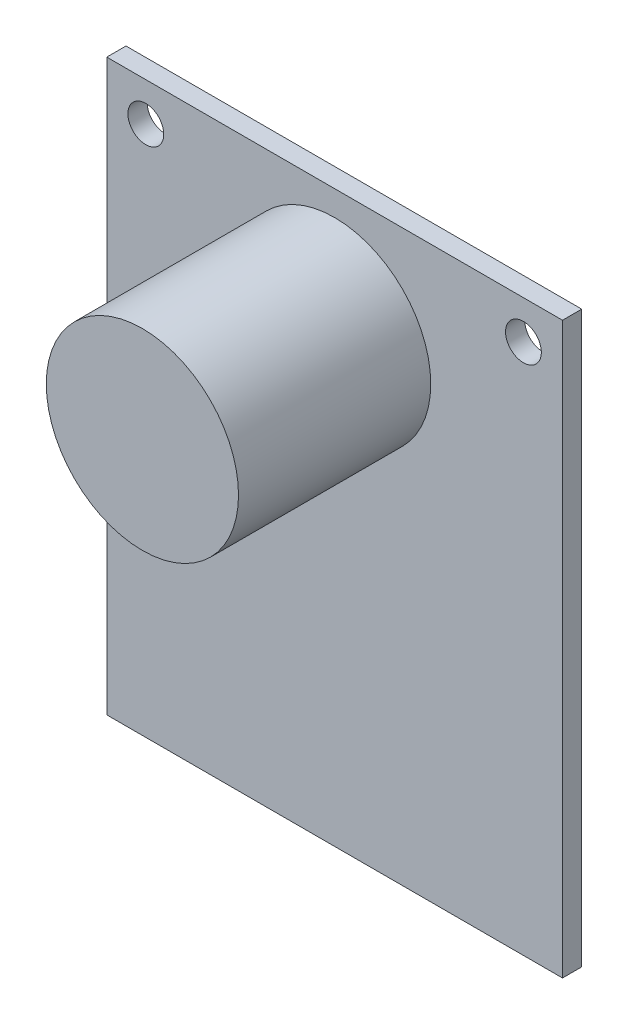
from build123d import *

# Parameters (mm, degrees)
SKETCH_1_W      = 35.56
SKETCH_1_H      = 44.45
SKETCH_1_R      = 1.397
EXTRUDE_1_DEPTH = 1.5
SKETCH_2_R      = 7.5
EXTRUDE_2_DEPTH = 15


with BuildPart() as part:
    # 草图1 → 凸台-拉伸1 (new body)
    with BuildSketch(Plane.XY):
        with Locations((0, 22.225)):
            Rectangle(SKETCH_1_W, SKETCH_1_H)
        with Locations((-14.732, 41.45)):
            Circle(SKETCH_1_R, mode=Mode.SUBTRACT)
        with Locations(Location((14.732, 41.45, 0), (0, 0, 180))):
            Circle(SKETCH_1_R, mode=Mode.SUBTRACT)
    extrude(amount=EXTRUDE_1_DEPTH)

    # 草图2 → 凸台-拉伸2 (add)
    with BuildSketch(Plane.XY.offset(1.5)):
        with Locations((0, 35)):
            Circle(SKETCH_2_R)
    extrude(amount=EXTRUDE_2_DEPTH)


solid = part.part
